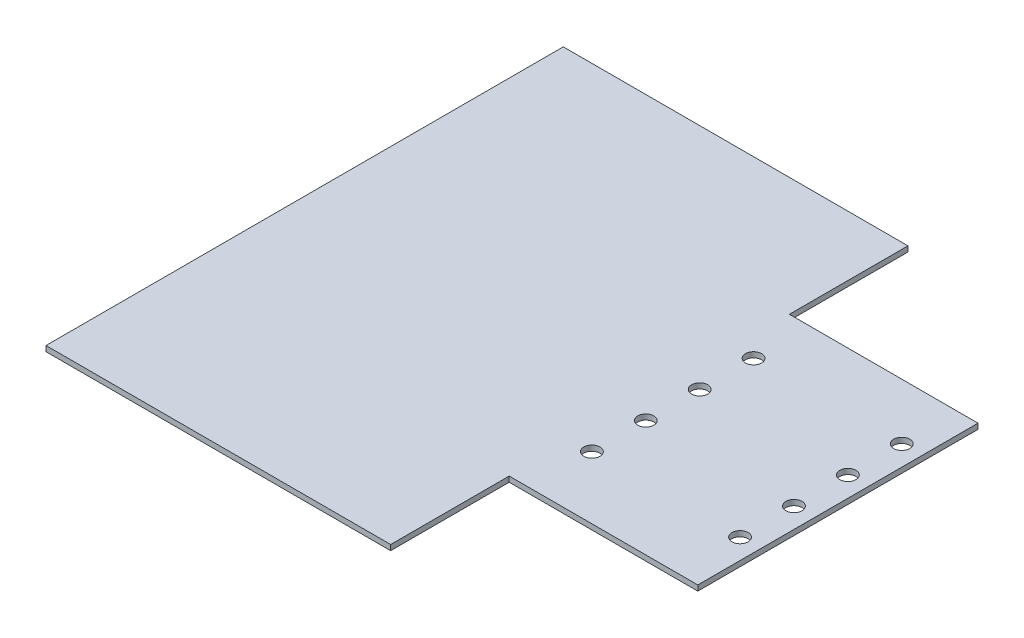
from build123d import *

# Parameters (mm, degrees)
EXTRUDE_1_DEPTH     = 1
SKETCH_2_R          = 1.5
CUT_EXTRUDE_1_DEPTH = 10


with BuildPart() as part:
    # Эскиз1 → Бобышка-Вытянуть1 (new body)
    with BuildSketch(Plane(origin=(0, 0, 0), x_dir=(1, 0, 0), z_dir=(0, 1, 0))):
        Polygon((15, -26), (15, -48), (-48.959081244, -48), (-48.959081244, 48), (15, 48), (15, 26), (50, 26), (50, -26), align=None)
    extrude(amount=EXTRUDE_1_DEPTH)

    # Эскиз2 → Вырез-Вытянуть1 (cut)
    with BuildSketch(Plane(origin=(0, 1, 0), x_dir=(1, 0, 0), z_dir=(0, 1, 0))):
        with Locations(Location((46.25, -14.4, 0), (0, 0, 270))):
            Circle(SKETCH_2_R)
        with Locations(Location((18.75, -14.4, 0), (0, 0, 270))):
            Circle(SKETCH_2_R)
        with Locations(Location((18.75, -4.4, 0), (0, 0, 270))):
            Circle(SKETCH_2_R)
        with Locations(Location((46.25, -4.4, 0), (0, 0, 270))):
            Circle(SKETCH_2_R)
        with Locations(Location((18.75, 5.6, 0), (0, 0, 270))):
            Circle(SKETCH_2_R)
        with Locations(Location((46.25, 5.6, 0), (0, 0, 270))):
            Circle(SKETCH_2_R)
        with Locations(Location((18.75, 15.6, 0), (0, 0, 270))):
            Circle(SKETCH_2_R)
        with Locations(Location((46.25, 15.6, 0), (0, 0, 270))):
            Circle(SKETCH_2_R)
    extrude(amount=-CUT_EXTRUDE_1_DEPTH, mode=Mode.SUBTRACT)


solid = part.part
